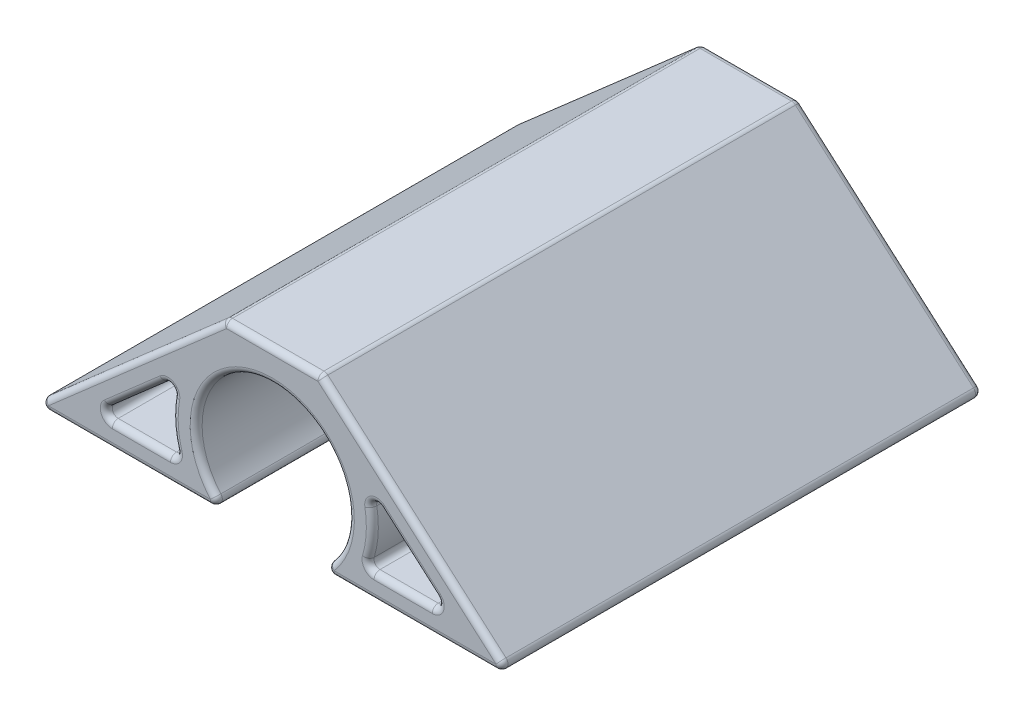
from build123d import *

# Parameters (mm, degrees)
BOSS_EXTRUDE1_DEPTH = 20
FILLET1_R           = 0.25
FILLET2_R           = 0.25


with BuildPart() as part:
    # Sketch1 → Boss-Extrude1 (new body)
    with BuildSketch(Plane.XY):
        with BuildLine():
            Line((1.957198253, -2.5), (10, -2.5))
            Line((10, -2.5), (2, 4.5))
            Line((2, 4.5), (0, 4.5))
            Line((0, 4.5), (-2, 4.5))
            Line((-2, 4.5), (-10, -2.5))
            Line((-10, -2.5), (-1.957198253, -2.5))
            ThreePointArc((-1.957198253, -2.5), (0, 3.175), (1.957198253, -2.5))
        make_face()
        with BuildLine():
            Line((3.896232154, -1.5), (7.338550598, -1.5))
            Line((7.338550598, -1.5), (3.889175098, 1.518203563))
            ThreePointArc((3.889175098, 1.518203563), (4.174988588, 0.00976181), (3.896232154, -1.5))
        make_face(mode=Mode.SUBTRACT)
        with BuildLine():
            Line((-7.338550598, -1.5), (-3.889175098, 1.518203563))
            ThreePointArc((-3.889175098, 1.518203563), (-4.174988588, 0.00976181), (-3.896232154, -1.5))
            Line((-3.896232154, -1.5), (-7.338550598, -1.5))
        make_face(mode=Mode.SUBTRACT)
    extrude(amount=BOSS_EXTRUDE1_DEPTH)

    # Fillet1
    fillet1_edges = [part.edges().sort_by_distance(p)[0] for p in [
        (7.338550598, -1.5, 10),
        (3.889175098, 1.518203563, 10),
        (3.896232154, -1.5, 10),
        (-7.338550598, -1.5, 10),
        (-3.896232154, -1.5, 10),
        (-3.889175098, 1.518203563, 10),
        (-1.957198253, -2.5, 10),
        (-10, -2.5, 10),
        (-2, 4.5, 10),
        (2, 4.5, 10),
        (10, -2.5, 10),
        (1.957198253, -2.5, 10),
    ]]
    fillet(fillet1_edges, radius=FILLET1_R)

    # Fillet2
    fillet2_edges = [part.edges().sort_by_distance(p)[0] for p in [
        (-5.784978087, 1.188144174, 0),
        (-5.784978087, 1.188144174, 20),
        (0, 3.175, 0),
        (-5.958454468, -2.5, 0),
        (0, 4.5, 0),
        (5.784978087, 1.188144174, 0),
        (5.958454468, -2.5, 0),
        (-5.679310119, -0.048164581, 0),
        (-5.458982225, -1.5, 0),
        (-4.16871116, -0.229068247, 0),
        (5.458982225, -1.5, 0),
        (5.679310119, -0.048164581, 0),
        (4.16871116, -0.229068247, 0),
        (-9.568663336, -2.337931668, 0),
        (2.35472086, -2.35354131, 0),
        (9.568663336, -2.337931668, 0),
        (-2.35472086, -2.35354131, 0),
        (1.993997889, 4.484025686, 0),
        (-1.993997889, 4.484025686, 0),
        (0, 4.5, 20),
        (0, 3.175, 20),
        (5.958454468, -2.5, 20),
        (5.784978087, 1.188144174, 20),
        (-5.958454468, -2.5, 20),
        (-5.679310119, -0.048164581, 20),
        (-4.16871116, -0.229068247, 20),
        (-5.458982225, -1.5, 20),
        (5.458982225, -1.5, 20),
        (4.16871116, -0.229068247, 20),
        (5.679310119, -0.048164581, 20),
        (-9.568663336, -2.337931668, 20),
        (2.35472086, -2.35354131, 20),
        (9.568663336, -2.337931668, 20),
        (-2.35472086, -2.35354131, 20),
        (1.993997889, 4.484025686, 20),
        (-1.993997889, 4.484025686, 20),
        (4.233202392, 0.995044121, 0),
        (4.233202392, 0.995044121, 20),
        (-4.233202392, 0.995044121, 0),
        (-4.233202392, 0.995044121, 20),
        (6.907213934, -1.337931668, 0),
        (6.907213934, -1.337931668, 20),
        (-4.044582087, -1.399740831, 0),
        (-4.044582087, -1.399740831, 20),
        (4.044582087, -1.399740831, 0),
        (4.044582087, -1.399740831, 20),
        (-6.907213934, -1.337931668, 0),
        (-6.907213934, -1.337931668, 20),
    ]]
    fillet(fillet2_edges, radius=FILLET2_R)


solid = part.part
